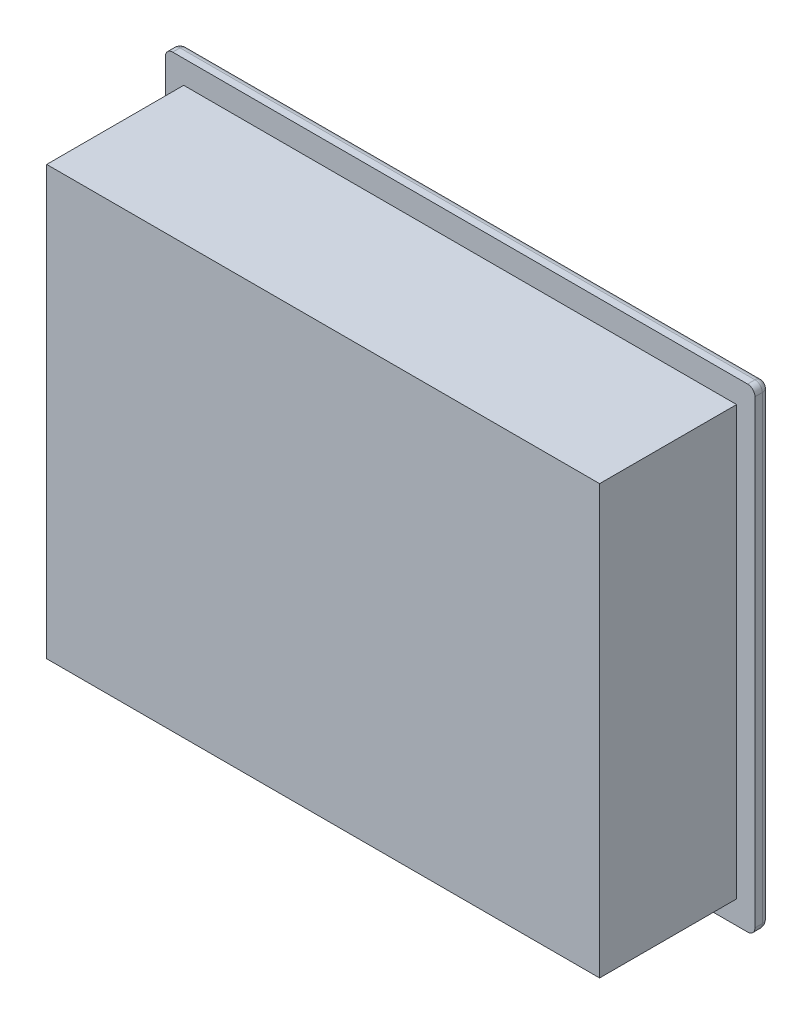
from build123d import *

# Parameters (mm, degrees)
SKETCH_1_W          = 241
SKETCH_1_H          = 194
EXTRUDE_1_DEPTH     = 6
SKETCH_2_W          = 226
SKETCH_2_H          = 175
EXTRUDE_2_DEPTH     = 56
FILLET_1_R          = 3
SKETCH_3_W          = 180
SKETCH_3_H          = 140
CUT_EXTRUDE_1_DEPTH = 1
EXTRUDE_3_DEPTH     = 1


with BuildPart() as part:
    # 草图1 → 凸台-拉伸1 (new body)
    with BuildSketch(Plane.XY):
        Rectangle(SKETCH_1_W, SKETCH_1_H)
    extrude(amount=EXTRUDE_1_DEPTH)

    # 草图2 → 凸台-拉伸2 (add)
    with BuildSketch(Plane.XY.offset(6)):
        Rectangle(SKETCH_2_W, SKETCH_2_H)
    extrude(amount=EXTRUDE_2_DEPTH)

    # 圆角1
    fillet_1_edges = [part.edges().sort_by_distance(p)[0] for p in [
        (0, -97, 0),
        (-120.5, 0, 0),
        (0, 97, 0),
        (120.5, 0, 0),
        (120.5, -97, 3),
        (-120.5, -97, 3),
        (-120.5, 97, 3),
        (120.5, 97, 3),
    ]]
    fillet(fillet_1_edges, radius=FILLET_1_R)

    # 草图3 → 切除-拉伸1 (cut)
    with BuildSketch(Plane(origin=(0, 0, 0), x_dir=(-1, 0, 0), z_dir=(0, 0, -1))):
        Rectangle(SKETCH_3_W, SKETCH_3_H)
    extrude(amount=-CUT_EXTRUDE_1_DEPTH, mode=Mode.SUBTRACT)

    # 草图4 → 凸台-拉伸3 (add)
    # profile 1 of 6: a face of its own
    with BuildSketch(Plane(origin=(0, 0, 1), x_dir=(-1, 0, 0), z_dir=(0, 0, -1))):
        with BuildLine():
            Line((-20.615877101, 5.215574709), (-21.755620691, 4.135192764))
            add(Edge.make_bspline(
                [(-21.755620691, 4.135192764), (-21.961863984, 4.329210084), (-22.369432581, 4.712618271), (-23.033897608, 5.210081483), (-23.727163658, 5.636234641), (-24.445613229, 5.982971042), (-25.17145444, 6.259631061), (-25.895052926, 6.456600188), (-26.608986395, 6.58221393), (-27.08382762, 6.59723536), (-27.317806855, 6.604637209)],
                knots=[0, 0, 0, 0, 1.08915593, 2.152340314, 3.188132944, 4.216796309, 5.218260357, 6.173443236, 7.099959455, 8, 8, 8, 8], degree=3))
            add(Edge.make_bspline(
                [(-27.317806855, 6.604637209), (-27.461379085, 6.602886277), (-27.748151184, 6.599388955), (-28.174117413, 6.554751777), (-28.595616177, 6.490553853), (-29.011851797, 6.39766657), (-29.423633576, 6.279941552), (-29.829529353, 6.132683091), (-30.230296288, 5.960999223), (-30.622159364, 5.762614751), (-31.002060829, 5.544683401), (-31.360864767, 5.303177913), (-31.700858155, 5.045838702), (-32.015650622, 4.766222889), (-32.307052913, 4.466863293), (-32.58200102, 4.15332863), (-32.830824907, 3.817052871), (-33.055577505, 3.464223055), (-33.256075023, 3.10103612), (-33.433064989, 2.730987797), (-33.581642662, 2.35530548), (-33.699200023, 1.973517751), (-33.796188458, 1.588578254), (-33.864419662, 1.197821604), (-33.902886786, 0.800829403), (-33.909540654, 0.534987675), (-33.912885648, 0.401345275)],
                knots=[0, 0, 0, 0, 1.02818874, 2.053710826, 3.065248034, 4.081641283, 5.106893873, 6.131558223, 7.173050175, 8.228653731, 9.27666206, 10.308777013, 11.325269123, 12.329503258, 13.32196095, 14.316845687, 15.314881793, 16.315733098, 17.311955233, 18.285320748, 19.252783886, 20.203351036, 21.145449891, 22.095197417, 23.042428769, 24, 24, 24, 24], degree=3))
            add(Edge.make_bspline(
                [(-33.912885648, 0.401345275), (-33.909686441, 0.264732149), (-33.903296762, -0.008121059), (-33.862401409, -0.415342633), (-33.786505191, -0.81651617), (-33.68504189, -1.212959933), (-33.558123104, -1.605352883), (-33.399912151, -1.991993841), (-33.212521109, -2.372868497), (-32.995619705, -2.744545075), (-32.757764777, -3.106592541), (-32.491305734, -3.44762785), (-32.208262598, -3.77219234), (-31.898323755, -4.07307974), (-31.571427693, -4.358338234), (-31.217807725, -4.620108611), (-30.844417309, -4.863433089), (-30.450686778, -5.085245021), (-30.040888333, -5.283401156), (-29.620701411, -5.459608983), (-29.188783658, -5.604724844), (-28.747404939, -5.722996151), (-28.297091422, -5.819940742), (-27.835557324, -5.882308242), (-27.366196192, -5.927566093), (-27.049802649, -5.930875163), (-26.890403009, -5.932542279)],
                knots=[0, 0, 0, 0, 0.93586088, 1.869166235, 2.799637598, 3.729985548, 4.670839027, 5.622275134, 6.589130586, 7.576015415, 8.568469353, 9.55398029, 10.53834874, 11.515998671, 12.510579167, 13.508179873, 14.527009472, 15.561807829, 16.601455013, 17.643573243, 18.680854198, 19.719860599, 20.772568776, 21.833555941, 22.908541556, 24, 24, 24, 24], degree=3))
            add(Edge.make_bspline(
                [(-26.890403009, -5.932542279), (-26.698301339, -5.928526639), (-26.3210785, -5.920641278), (-25.766569226, -5.859256719), (-25.234002893, -5.763385293), (-24.724875966, -5.622982997), (-24.238597112, -5.443897439), (-23.77338366, -5.22801697), (-23.332898305, -4.967061353), (-22.915816871, -4.672531983), (-22.531611452, -4.344385859), (-22.18509566, -3.990290998), (-21.881796422, -3.611966183), (-21.617193195, -3.211639681), (-21.398293225, -2.78599789), (-21.218618726, -2.337126709), (-21.080894458, -1.864824242), (-21.024358398, -1.538469668), (-20.995791631, -1.37356792)],
                knots=[0, 0, 0, 0, 1.13008108, 2.219097802, 3.278683437, 4.311054135, 5.322181354, 6.324827112, 7.324222904, 8.330512327, 9.32562643, 10.293043162, 11.24128371, 12.174520618, 13.111833804, 14.052305215, 15.015860969, 16, 16, 16, 16], degree=3))
            Line((-20.995791631, -1.37356792), (-25.93468052, -1.37356792))
            Line((-25.93468052, -1.37356792), (-25.93468052, 0.1460902))
            Line((-25.93468052, 0.1460902), (-19.666090776, 0.1460902))
            add(Edge.make_bspline(
                [(-19.666090776, 0.1460902), (-19.673312201, -0.137151503), (-19.687445834, -0.691506679), (-19.78658591, -1.499947493), (-19.946675812, -2.263520994), (-20.165371132, -2.983031331), (-20.448476486, -3.657458874), (-20.792953523, -4.287488374), (-21.204315502, -4.869049656), (-21.667909704, -5.406890438), (-22.188186192, -5.88665077), (-22.751086683, -6.308315907), (-23.357541183, -6.663503645), (-24.006976034, -6.952473783), (-24.697265203, -7.178000361), (-25.43000601, -7.337900036), (-26.204204787, -7.433700214), (-26.734796719, -7.445940387), (-27.006158217, -7.452200398)],
                knots=[0, 0, 0, 0, 1.140356446, 2.231883559, 3.274166699, 4.278491846, 5.25512956, 6.21435461, 7.1637429, 8.11826594, 9.068280886, 10.0076534, 10.945064095, 11.891975133, 12.864533718, 13.863980011, 14.907571808, 16, 16, 16, 16], degree=3))
            add(Edge.make_bspline(
                [(-27.006158217, -7.452200398), (-27.173417791, -7.449791118), (-27.503307575, -7.445039242), (-27.990525838, -7.411268471), (-28.464310431, -7.359280698), (-28.924592336, -7.280773009), (-29.373064651, -7.184614306), (-29.80748756, -7.06148053), (-30.229515935, -6.918949703), (-30.639802074, -6.756831352), (-31.034621989, -6.568991339), (-31.415734244, -6.360247198), (-31.78524551, -6.131675304), (-32.140638775, -5.879322724), (-32.483765772, -5.605076976), (-32.812414017, -5.308388386), (-33.128423368, -4.990163979), (-33.326375997, -4.764192838), (-33.426120157, -4.65033074)],
                knots=[0, 0, 0, 0, 1.107784379, 2.184907829, 3.233506516, 4.263428166, 5.276301166, 6.270063455, 7.25232949, 8.225834625, 9.190232166, 10.146266622, 11.1027726, 12.066435141, 13.031522626, 14.010570082, 14.99756817, 16, 16, 16, 16], degree=3))
            add(Edge.make_bspline(
                [(-33.426120157, -4.65033074), (-33.570840602, -4.469691642), (-33.857879282, -4.11141187), (-34.227356812, -3.537372105), (-34.54232275, -2.94300423), (-34.797879864, -2.326653637), (-34.997431096, -1.688896836), (-35.140544233, -1.03054877), (-35.22439509, -0.350761667), (-35.236475066, 0.10925462), (-35.242586503, 0.34198363)],
                knots=[0, 0, 0, 0, 1.023165419, 2.029347347, 3.013907458, 3.994755782, 4.975994455, 5.96558838, 6.970761222, 8, 8, 8, 8], degree=3))
            add(Edge.make_bspline(
                [(-35.242586503, 0.34198363), (-35.240333361, 0.516254099), (-35.235855714, 0.862580167), (-35.181561029, 1.376749436), (-35.103661693, 1.881789033), (-34.989162495, 2.377286121), (-34.844821641, 2.863571626), (-34.664678551, 3.34087134), (-34.454938491, 3.809466929), (-34.211159891, 4.266132971), (-33.939869012, 4.704809651), (-33.645439746, 5.123731019), (-33.323691172, 5.515268061), (-32.97987762, 5.884379372), (-32.609897029, 6.226427824), (-32.217215468, 6.544580226), (-31.801530317, 6.839263346), (-31.361533822, 7.105835646), (-30.903793291, 7.345288306), (-30.429405951, 7.555215969), (-29.938516615, 7.728712004), (-29.43480296, 7.875921005), (-28.914452207, 7.984781767), (-28.381240434, 8.063728122), (-27.832388293, 8.117747994), (-27.461395769, 8.122092477), (-27.273285621, 8.124295328)],
                knots=[0, 0, 0, 0, 1.008945113, 2.00506715, 2.99143336, 3.967273523, 4.948097931, 5.927297278, 6.919902385, 7.919676788, 8.923139349, 9.905703106, 10.883022732, 11.856032218, 12.825136022, 13.798837087, 14.781400844, 15.773989409, 16.776158564, 17.77167057, 18.775803737, 19.789618931, 20.80898985, 21.851988756, 22.910860228, 24, 24, 24, 24], degree=3))
            add(Edge.make_bspline(
                [(-27.273285621, 8.124295328), (-27.119877056, 8.121842147), (-26.8156859, 8.116977775), (-26.363033633, 8.083260765), (-25.917377871, 8.029819669), (-25.478057821, 7.956892939), (-25.046569537, 7.857563316), (-24.621683817, 7.738698577), (-24.202784747, 7.600303195), (-23.791185159, 7.435250412), (-23.384117494, 7.247910067), (-22.97931837, 7.037033245), (-22.578170895, 6.799014059), (-22.179979407, 6.533145758), (-21.782232942, 6.243994623), (-21.391222623, 5.923290736), (-20.997510159, 5.58368107), (-20.744349145, 5.339493158), (-20.615877101, 5.215574709)],
                knots=[0, 0, 0, 0, 0.985871117, 1.954866573, 2.915460327, 3.869826059, 4.81536089, 5.759505086, 6.70452669, 7.649098992, 8.607881297, 9.583363685, 10.581137262, 11.603961102, 12.659522466, 13.73993555, 14.853081303, 16, 16, 16, 16], degree=3))
        make_face()
    # profile 2 of 6: a face of its own
    with BuildSketch(Plane(origin=(0, 0, 1), x_dir=(-1, 0, 0), z_dir=(0, 0, -1))):
        Polygon((-18.336389922, 6.224722679), (-18.336389922, 7.744380798), (-10.548142058, 7.744380798), (-10.548142058, 6.224722679), (-13.777415563, 6.224722679), (-13.777415563, -7.072285868), (-15.107116417, -7.072285868), (-15.107116417, 6.224722679), align=None)
    # profile 3 of 6: a face of its own
    with BuildSketch(Plane(origin=(0, 0, 1), x_dir=(-1, 0, 0), z_dir=(0, 0, -1))):
        with BuildLine():
            Line((-7.698783084, 3.185406439), (-9.028483939, 3.185406439))
            add(Edge.make_bspline(
                [(-9.028483939, 3.185406439), (-9.019817658, 3.361813198), (-9.002797312, 3.708271376), (-8.923090888, 4.213409246), (-8.809041174, 4.696241228), (-8.647787352, 5.15289053), (-8.44752411, 5.587394814), (-8.207366994, 5.998028214), (-7.922913026, 6.383224246), (-7.600304519, 6.739412016), (-7.24991728, 7.066172732), (-6.87185547, 7.348346594), (-6.474578188, 7.586758069), (-6.059290732, 7.786068659), (-5.62130768, 7.935674007), (-5.164603582, 8.046678948), (-4.687171904, 8.113465478), (-4.361882477, 8.120644304), (-4.196446011, 8.124295328)],
                knots=[0, 0, 0, 0, 1.10065271, 2.161652631, 3.183658789, 4.190468796, 5.17591951, 6.163126047, 7.15150782, 8.156236427, 9.156009102, 10.134482811, 11.092018607, 12.041330605, 13.001268258, 13.972401359, 14.968799086, 16, 16, 16, 16], degree=3))
            add(Edge.make_bspline(
                [(-4.196446011, 8.124295328), (-4.033978831, 8.120491863), (-3.714736625, 8.113018189), (-3.248807431, 8.048836498), (-2.805250218, 7.948313493), (-2.384932006, 7.807278231), (-1.991206333, 7.617690822), (-1.621115444, 7.389947908), (-1.270253345, 7.126550622), (-0.954417961, 6.816442812), (-0.664400426, 6.485386051), (-0.414200879, 6.131953925), (-0.199938487, 5.766916616), (-0.021343975, 5.387490563), (0.110127013, 4.990103209), (0.209941427, 4.58054005), (0.266360812, 4.154561684), (0.275019771, 3.866243932), (0.279422044, 3.719661247)],
                knots=[0, 0, 0, 0, 1.111607364, 2.184268762, 3.212621178, 4.221274766, 5.211760367, 6.196651075, 7.1921475, 8.207485113, 9.220403448, 10.201281604, 11.166441695, 12.114753415, 13.065576456, 14.026450734, 14.996634279, 16, 16, 16, 16], degree=3))
            add(Edge.make_bspline(
                [(0.279422044, 3.719661247), (0.272253898, 3.513295414), (0.258043397, 3.104185176), (0.136485869, 2.502988924), (-0.053364361, 1.920510116), (-0.281953172, 1.451722204), (-0.512553185, 1.073967081), (-0.720356967, 0.762949563), (-0.963624667, 0.428069747), (-1.245896975, 0.070449019), (-1.5613348, -0.312713813), (-1.912795292, -0.72118728), (-2.302784699, -1.150751106), (-2.576505686, -1.444144818), (-2.718341043, -1.596174089)],
                knots=[0, 0, 0, 0, 1.184426356, 2.348067706, 3.509069118, 4.696110526, 5.333549288, 6.050745305, 6.844228056, 7.710549037, 8.667450064, 9.695053472, 10.805634456, 12, 12, 12, 12], degree=3))
            Line((-2.718341043, -1.596174089), (-6.425475792, -5.552627749))
            Line((-6.425475792, -5.552627749), (0.469379309, -5.552627749))
            Line((0.469379309, -5.552627749), (0.469379309, -7.072285868))
            Line((0.469379309, -7.072285868), (-9.598355733, -7.072285868))
            Line((-9.598355733, -7.072285868), (-3.852148469, -0.940227909))
            add(Edge.make_bspline(
                [(-3.852148469, -0.940227909), (-3.712245748, -0.794185078), (-3.443521253, -0.513666688), (-3.063441678, -0.10412149), (-2.722069961, 0.275818232), (-2.417196331, 0.625434621), (-2.155434492, 0.949841591), (-1.923142043, 1.238532503), (-1.737021041, 1.504193009), (-1.535025866, 1.812128275), (-1.339386678, 2.188100418), (-1.171271038, 2.647559702), (-1.068761513, 3.120538405), (-1.056464376, 3.440163695), (-1.05027881, 3.600937956)],
                knots=[0, 0, 0, 0, 1.329631726, 2.553950428, 3.673215718, 4.687767853, 5.603093632, 6.413772471, 7.123043292, 7.734684054, 8.834405432, 9.900288307, 10.943827018, 12, 12, 12, 12], degree=3))
            add(Edge.make_bspline(
                [(-1.05027881, 3.600937956), (-1.052970119, 3.702035876), (-1.058274173, 3.901280463), (-1.105085092, 4.193404843), (-1.175826235, 4.475195888), (-1.277194494, 4.747520376), (-1.41099636, 5.007640303), (-1.573867002, 5.255872302), (-1.761784937, 5.495855588), (-1.979171977, 5.720871217), (-2.217980744, 5.926954986), (-2.470263068, 6.109513615), (-2.737175176, 6.262079184), (-3.017591693, 6.387146655), (-3.310730847, 6.485255769), (-3.617159601, 6.553237088), (-3.93603127, 6.595919604), (-4.153766402, 6.601694598), (-4.264711903, 6.604637209)],
                knots=[0, 0, 0, 0, 0.991446411, 1.95395049, 2.89581595, 3.838931463, 4.798493298, 5.75982156, 6.748411868, 7.785213223, 8.824556874, 9.840280684, 10.836137867, 11.835679398, 12.848801643, 13.863922112, 14.911575587, 16, 16, 16, 16], degree=3))
            add(Edge.make_bspline(
                [(-4.264711903, 6.604637209), (-4.380581762, 6.601610239), (-4.608131033, 6.59566577), (-4.942221605, 6.554083159), (-5.260931397, 6.482345768), (-5.565062119, 6.384231179), (-5.855128366, 6.259523323), (-6.129719486, 6.104194937), (-6.38821905, 5.918844816), (-6.631112999, 5.708699794), (-6.854903844, 5.474733616), (-7.051528952, 5.213918105), (-7.223334612, 4.93101538), (-7.3732337, 4.626788783), (-7.494966121, 4.298477781), (-7.587985792, 3.94724783), (-7.661590109, 3.574623982), (-7.686179513, 3.317300456), (-7.698783084, 3.185406439)],
                knots=[0, 0, 0, 0, 1.031018746, 2.02475058, 2.990194455, 3.934040569, 4.864654155, 5.795059489, 6.735614925, 7.690564532, 8.649604399, 9.611025574, 10.590972636, 11.591080095, 12.624614302, 13.701020113, 14.821632451, 16, 16, 16, 16], degree=3))
        make_face()
    # profile 4 of 6: a face of its own
    with BuildSketch(Plane(origin=(0, 0, 1), x_dir=(-1, 0, 0), z_dir=(0, 0, -1))):
        with BuildLine():
            Line((3.698652814, 4.325150029), (2.368951959, 4.325150029))
            add(Edge.make_bspline(
                [(2.368951959, 4.325150029), (2.404975723, 4.474300878), (2.475399237, 4.765878588), (2.622285631, 5.182469325), (2.782302478, 5.576692233), (2.974449687, 5.941165611), (3.184036747, 6.2832143), (3.424162935, 6.59508026), (3.68374976, 6.884695147), (3.970875379, 7.141714519), (4.271986713, 7.374453573), (4.591326603, 7.572891316), (4.922470187, 7.743596896), (5.267711783, 7.884229211), (5.628079243, 7.990170595), (6.000314648, 8.067034405), (6.385393465, 8.116950122), (6.646791599, 8.121821685), (6.779522205, 8.124295328)],
                knots=[0, 0, 0, 0, 1.162005537, 2.271625781, 3.343758855, 4.383309926, 5.390229558, 6.379919256, 7.361854164, 8.333198761, 9.295911338, 10.242430842, 11.177959212, 12.116337295, 13.062827104, 14.020064771, 14.994644689, 16, 16, 16, 16], degree=3))
            add(Edge.make_bspline(
                [(6.779522205, 8.124295328), (6.972912479, 8.118456587), (7.355474626, 8.106906464), (7.917504858, 8.00143535), (8.459485059, 7.834535623), (8.975482874, 7.603930178), (9.454774239, 7.319503885), (9.881224096, 6.980986499), (10.249052125, 6.594909456), (10.557638324, 6.168474934), (10.79925582, 5.712733278), (10.977421468, 5.243679279), (11.085886584, 4.7624256), (11.099943608, 4.437486452), (11.106986147, 4.274692631)],
                knots=[0, 0, 0, 0, 1.083050992, 2.142477498, 3.193116406, 4.255571735, 5.30263384, 6.308962982, 7.297363603, 8.282367274, 9.249857812, 10.179914175, 11.08814088, 12, 12, 12, 12], degree=3))
            add(Edge.make_bspline(
                [(11.106986147, 4.274692631), (11.102060278, 4.118030533), (11.092421117, 3.811467119), (11.010575097, 3.363912781), (10.872838251, 2.942096673), (10.682042923, 2.544243087), (10.435063693, 2.172874598), (10.13588261, 1.82715566), (9.782388008, 1.505552891), (9.514507171, 1.321320455), (9.376594186, 1.226472144)],
                knots=[0, 0, 0, 0, 1.024540389, 2.004866551, 2.965041327, 3.920577974, 4.882998113, 5.874504559, 6.905732034, 8, 8, 8, 8], degree=3))
            add(Edge.make_bspline(
                [(9.376594186, 1.226472144), (9.534208614, 1.150364552), (9.846488382, 0.999573398), (10.27215229, 0.703850691), (10.658561963, 0.362405487), (10.874054373, 0.095948256), (10.982326692, -0.0379309)],
                knots=[0, 0, 0, 0, 1.015518401, 2.012035669, 3.001164323, 4, 4, 4, 4], degree=3))
            add(Edge.make_bspline(
                [(10.982326692, -0.0379309), (11.053621708, -0.135542049), (11.195044234, -0.329165896), (11.369607994, -0.640470099), (11.527973244, -0.955224737), (11.65137584, -1.281866222), (11.746938543, -1.616608647), (11.815247746, -1.96002679), (11.857683275, -2.312401085), (11.863760446, -2.550790585), (11.866815207, -2.670619869)],
                knots=[0, 0, 0, 0, 1.025084078, 2.033381695, 3.024893161, 4.013698104, 4.991890475, 5.976764909, 6.982997093, 8, 8, 8, 8], degree=3))
            add(Edge.make_bspline(
                [(11.866815207, -2.670619869), (11.859218433, -2.878094356), (11.844060636, -3.29206695), (11.708576721, -3.903676605), (11.498547335, -4.501531231), (11.20027964, -5.073348051), (10.836773852, -5.60835833), (10.404307847, -6.087048039), (9.907795384, -6.49852213), (9.354051471, -6.842312096), (8.754115627, -7.1171313), (8.112445621, -7.307874475), (7.438287059, -7.432105873), (6.975976166, -7.445427618), (6.740937135, -7.452200398)],
                knots=[0, 0, 0, 0, 0.955779014, 1.907060117, 2.875433937, 3.871313158, 4.872415639, 5.851225146, 6.836215519, 7.83643374, 8.849228613, 9.86973379, 10.916971861, 12, 12, 12, 12], degree=3))
            add(Edge.make_bspline(
                [(6.740937135, -7.452200398), (6.582528764, -7.448524962), (6.270833912, -7.441292929), (5.812603103, -7.391853518), (5.375207909, -7.301556496), (4.958056944, -7.180045836), (4.560779624, -7.025987461), (4.184588245, -6.834138306), (3.827168362, -6.608452948), (3.491892803, -6.346267426), (3.178801533, -6.052976421), (2.896215, -5.723373279), (2.639421877, -5.363550936), (2.415298039, -4.969329998), (2.21363494, -4.545805075), (2.04776889, -4.087553099), (1.901779983, -3.598670739), (1.833904984, -3.257981639), (1.799080164, -3.083183304)],
                knots=[0, 0, 0, 0, 1.048658725, 2.063410685, 3.046034179, 4.001477787, 4.936774919, 5.862367409, 6.792675028, 7.730719943, 8.675894397, 9.627829632, 10.600096036, 11.597688215, 12.626045268, 13.701542398, 14.82072376, 16, 16, 16, 16], degree=3))
            Line((1.799080164, -3.083183304), (3.128781019, -3.083183304))
            add(Edge.make_bspline(
                [(3.128781019, -3.083183304), (3.163423619, -3.19726746), (3.230806486, -3.419171054), (3.345505681, -3.738535014), (3.476181366, -4.031304106), (3.616366331, -4.299625989), (3.763595086, -4.54614316), (3.928334936, -4.764337072), (4.098384317, -4.963791428), (4.226566913, -5.076163619), (4.289301184, -5.131160067)],
                knots=[0, 0, 0, 0, 1.198163088, 2.33053128, 3.407730985, 4.417276592, 5.372219308, 6.28897303, 7.162600585, 8, 8, 8, 8], degree=3))
            add(Edge.make_bspline(
                [(4.289301184, -5.131160067), (4.372260025, -5.195118681), (4.537921631, -5.322838482), (4.807873809, -5.485828709), (5.091781827, -5.62705705), (5.395797281, -5.734938028), (5.71335981, -5.826283459), (6.049602322, -5.886060323), (6.401558342, -5.927073582), (6.641875207, -5.930692792), (6.764681793, -5.932542279)],
                knots=[0, 0, 0, 0, 0.946170439, 1.889420265, 2.845303464, 3.807233317, 4.801018734, 5.828864929, 6.890507805, 8, 8, 8, 8], degree=3))
            add(Edge.make_bspline(
                [(6.764681793, -5.932542279), (6.903338288, -5.929934946), (7.174469093, -5.924836533), (7.570094664, -5.877949374), (7.946469526, -5.809663957), (8.299414911, -5.704198997), (8.633554059, -5.573893392), (8.944203043, -5.410281809), (9.235439892, -5.218322488), (9.503534375, -5.000140049), (9.74460369, -4.761289054), (9.956860963, -4.511467053), (10.137305363, -4.251727374), (10.282862511, -3.980632662), (10.39779984, -3.699305527), (10.47604539, -3.406956483), (10.530450137, -3.105978056), (10.534880795, -2.90138542), (10.537114352, -2.798247407)],
                knots=[0, 0, 0, 0, 1.217147791, 2.380027433, 3.494444702, 4.572153297, 5.609568379, 6.639424714, 7.649109417, 8.668170816, 9.669597737, 10.625200337, 11.543417969, 12.441394052, 13.322311151, 14.205496177, 15.095365482, 16, 16, 16, 16], degree=3))
            add(Edge.make_bspline(
                [(10.537114352, -2.798247407), (10.530636076, -2.660192739), (10.517711758, -2.384770344), (10.419038771, -1.979565946), (10.256737579, -1.5891535), (10.029523948, -1.220193989), (9.75293603, -0.878242672), (9.429657925, -0.573140063), (9.057005091, -0.321383344), (8.714020979, -0.147441366), (8.41021515, -0.028751081), (8.150223356, 0.050306269), (7.859153735, 0.117250744), (7.540526191, 0.179532694), (7.191939908, 0.232539734), (6.813774387, 0.276743421), (6.405952997, 0.312113094), (6.123627061, 0.327908064), (5.978139993, 0.336047465)],
                knots=[0, 0, 0, 0, 1.07054697, 2.135767047, 3.216561865, 4.33974944, 5.486079747, 6.621378074, 7.775625952, 8.963672916, 9.598146892, 10.304877434, 11.070270905, 11.915000392, 12.823868403, 13.805723172, 14.86925407, 16, 16, 16, 16], degree=3))
            Line((5.978139993, 0.336047465), (5.978139993, 1.855705585))
            add(Edge.make_bspline(
                [(5.978139993, 1.855705585), (6.161448261, 1.858816254), (6.520504128, 1.86490929), (7.044990018, 1.938603201), (7.54652704, 2.040544526), (8.014000248, 2.19669184), (8.440079801, 2.378049097), (8.809732783, 2.589090117), (9.117780373, 2.823679223), (9.362725576, 3.085437269), (9.54699931, 3.36617097), (9.681732753, 3.658764821), (9.761320801, 3.965783345), (9.771945057, 4.175310773), (9.777285292, 4.280628795)],
                knots=[0, 0, 0, 0, 1.321986639, 2.589447074, 3.816329219, 5.01088745, 6.139805852, 7.153945165, 8.075214402, 8.924034688, 9.728124013, 10.488707548, 11.240355623, 12, 12, 12, 12], degree=3))
            add(Edge.make_bspline(
                [(9.777285292, 4.280628795), (9.775530952, 4.358004583), (9.772040777, 4.511940043), (9.728025634, 4.736836167), (9.661883861, 4.954856838), (9.570953007, 5.165074902), (9.449243832, 5.366032394), (9.303591822, 5.559442595), (9.130160198, 5.744201259), (8.931424472, 5.916414612), (8.718014498, 6.080537716), (8.484123783, 6.219872113), (8.236804514, 6.339019542), (7.975782875, 6.437273101), (7.700211797, 6.511184088), (7.411386036, 6.564252483), (7.108754842, 6.597431888), (6.902287844, 6.602208849), (6.797330698, 6.604637209)],
                knots=[0, 0, 0, 0, 0.884392785, 1.759457502, 2.611959086, 3.489218968, 4.37281399, 5.2945488, 6.255912374, 7.266815255, 8.301784654, 9.332968512, 10.37626691, 11.440494194, 12.520033166, 13.637162961, 14.798855837, 16, 16, 16, 16], degree=3))
            add(Edge.make_bspline(
                [(6.797330698, 6.604637209), (6.628625304, 6.598747109), (6.29910443, 6.587242376), (5.824061282, 6.486476286), (5.382442768, 6.325702399), (5.044882413, 6.133792617), (4.795612849, 5.944349113), (4.617487144, 5.778900344), (4.44256365, 5.595034724), (4.282350284, 5.381427602), (4.120323783, 5.152544857), (3.972815139, 4.896751272), (3.829475776, 4.620719336), (3.743104982, 4.42558115), (3.698652814, 4.325150029)],
                knots=[0, 0, 0, 0, 1.472543308, 2.876219568, 4.221790263, 5.565193594, 6.249813518, 6.953379497, 7.687249741, 8.463570142, 9.283606569, 10.136032583, 11.040678096, 12, 12, 12, 12], degree=3))
        make_face()
    # profile 5 of 6: a face of its own
    with BuildSketch(Plane(origin=(0, 0, 1), x_dir=(-1, 0, 0), z_dir=(0, 0, -1))):
        with BuildLine():
            add(Edge.make_bspline(
                [(13.196516061, 0.3301113), (13.197904672, 0.567590242), (13.200602067, 1.028896509), (13.230609716, 1.701084827), (13.280458665, 2.331683383), (13.348773543, 2.920722363), (13.431907659, 3.468353833), (13.542886553, 3.973114305), (13.669094084, 4.437339973), (13.815366104, 4.862544644), (13.980414411, 5.254456921), (14.160052782, 5.620323606), (14.361410411, 5.95959112), (14.572979343, 6.277674432), (14.803323779, 6.56936674), (15.045888659, 6.838787345), (15.310141268, 7.079709522), (15.58709867, 7.299192202), (15.879268369, 7.491594965), (16.178322323, 7.661066892), (16.486318937, 7.80584633), (16.804099112, 7.919682509), (17.128806607, 8.013708427), (17.461576522, 8.078008305), (17.802958296, 8.118465884), (18.033384704, 8.122333745), (18.150245362, 8.124295328)],
                knots=[0, 0, 0, 0, 1.646270934, 3.197905019, 4.663502075, 6.030701355, 7.308322542, 8.50163776, 9.611534131, 10.641858119, 11.616356847, 12.558055219, 13.465016945, 14.349605745, 15.204443733, 16.039544428, 16.859896111, 17.680448484, 18.487036065, 19.28249412, 20.06191084, 20.843045899, 21.620316918, 22.403196591, 23.190181807, 24, 24, 24, 24], degree=3))
            add(Edge.make_bspline(
                [(18.150245362, 8.124295328), (18.268082221, 8.122230244), (18.502422658, 8.118123441), (18.848880247, 8.078652084), (19.187333899, 8.013157663), (19.516340686, 7.920358871), (19.838603129, 7.805230506), (20.151600588, 7.660928377), (20.457277234, 7.492954506), (20.750775451, 7.295580092), (21.035317323, 7.075521789), (21.303913699, 6.826759824), (21.55658903, 6.551806013), (21.796514489, 6.253602122), (22.016883184, 5.926428597), (22.226744047, 5.575975865), (22.414585666, 5.196115204), (22.595495791, 4.793184557), (22.751650701, 4.356035068), (22.892477806, 3.887130915), (23.00626544, 3.380933524), (23.101046693, 2.840098752), (23.174473419, 2.262640407), (23.227951604, 1.649796338), (23.256200997, 1.001163351), (23.261521032, 0.557688456), (23.264251104, 0.3301113)],
                knots=[0, 0, 0, 0, 0.810914788, 1.612654377, 2.396697861, 3.181598691, 3.963628158, 4.749916497, 5.551656086, 6.361998678, 7.18212741, 8.025565596, 8.878627764, 9.750805457, 10.657531673, 11.591944965, 12.560506719, 13.57287815, 14.630710178, 15.753379473, 16.941251878, 18.199788006, 19.531962791, 20.947069417, 22.433333509, 24, 24, 24, 24], degree=3))
            add(Edge.make_bspline(
                [(23.264251104, 0.3301113), (23.26149273, 0.103526757), (23.256118149, -0.337963986), (23.228268291, -0.983678448), (23.173410085, -1.593270165), (23.104787801, -2.168201123), (23.009745391, -2.706078376), (22.892883521, -3.208763207), (22.763130488, -3.678426444), (22.602963193, -4.11122048), (22.427657852, -4.513182773), (22.236924188, -4.888540368), (22.032581925, -5.240611007), (21.809956237, -5.566576602), (21.572663455, -5.868746251), (21.315624816, -6.141786187), (21.046086005, -6.392275365), (20.760706778, -6.615167254), (20.462631211, -6.810259594), (20.158004453, -6.98473156), (19.841421463, -7.125416636), (19.52005663, -7.246214976), (19.189313213, -7.338503556), (18.849603493, -7.402316211), (18.502655427, -7.447070369), (18.268122135, -7.450484468), (18.150245362, -7.452200398)],
                knots=[0, 0, 0, 0, 1.561518951, 3.042555995, 4.452378317, 5.7783523, 7.031515105, 8.214008947, 9.334062868, 10.386615937, 11.391082383, 12.354592575, 13.286541444, 14.194233754, 15.072674879, 15.931287219, 16.775624067, 17.606195743, 18.42308326, 19.229000347, 20.022332153, 20.807536673, 21.593273796, 22.3848459, 23.188221202, 24, 24, 24, 24], degree=3))
            add(Edge.make_bspline(
                [(18.150245362, -7.452200398), (18.033387946, -7.45022616), (17.802967931, -7.446333348), (17.46153933, -7.406058551), (17.130143653, -7.341307588), (16.807145594, -7.250643964), (16.490888013, -7.139667823), (16.1856804, -6.995083896), (15.888129206, -6.828569671), (15.599028285, -6.63893572), (15.323810137, -6.421673928), (15.060926041, -6.181371773), (14.816980127, -5.912032665), (14.589929122, -5.617909457), (14.374138815, -5.301708065), (14.175640468, -4.959111285), (13.992037186, -4.591477568), (13.824213075, -4.196431746), (13.675417067, -3.768209218), (13.543981769, -3.301911029), (13.440205169, -2.793421503), (13.351377325, -2.246824648), (13.27973077, -1.659771677), (13.230817459, -1.031943882), (13.200585892, -0.363732498), (13.197897427, 0.094609547), (13.196516061, 0.3301113)],
                knots=[0, 0, 0, 0, 0.810891512, 1.598919785, 2.382837074, 3.152667961, 3.926044502, 4.706494248, 5.493654104, 6.291793342, 7.103789334, 7.925228297, 8.761435821, 9.622817696, 10.50288917, 11.416980706, 12.369136599, 13.353924996, 14.394355917, 15.514179734, 16.714354668, 17.994756427, 19.357759367, 20.818452758, 22.365282078, 24, 24, 24, 24], degree=3))
        make_face()
        with BuildLine():
            add(Edge.make_bspline(
                [(14.526216916, 0.336047465), (14.526722575, 0.13814464), (14.527703961, -0.245945883), (14.553341876, -0.804082354), (14.588267859, -1.324656746), (14.633316017, -1.808330051), (14.700215165, -2.253465104), (14.7751739, -2.663123429), (14.866394147, -3.035137066), (14.974323056, -3.372058798), (15.097255232, -3.679606521), (15.231476722, -3.965784998), (15.375667116, -4.233974863), (15.537038186, -4.481767138), (15.712785287, -4.709969899), (15.898938751, -4.922622223), (16.102446024, -5.112262777), (16.383978534, -5.339706464), (16.755650276, -5.574737463), (17.223943537, -5.779402577), (17.705139979, -5.908021642), (18.031746938, -5.924378209), (18.194766596, -5.932542279)],
                knots=[0, 0, 0, 0, 1.459021318, 2.831673884, 4.118529203, 5.306027144, 6.411944654, 7.436330062, 8.375795394, 9.233974572, 10.042671642, 10.816086306, 11.563610507, 12.285937304, 12.993564865, 13.685989202, 14.367179055, 15.041617293, 16.353048772, 17.594441528, 18.799311195, 20, 20, 20, 20], degree=3))
            add(Edge.make_bspline(
                [(18.194766596, -5.932542279), (18.358840739, -5.92577834), (18.686650274, -5.912264427), (19.16558334, -5.781883106), (19.630531483, -5.585162055), (19.994902697, -5.352550949), (20.272112131, -5.131027688), (20.470727389, -4.94215901), (20.653023394, -4.730679172), (20.825921511, -4.502505486), (20.984498265, -4.253278636), (21.128698881, -3.984197067), (21.260285052, -3.694513547), (21.335253347, -3.492288319), (21.373582701, -3.388895778)],
                knots=[0, 0, 0, 0, 1.353760809, 2.704726607, 4.075137775, 5.516104923, 6.260822281, 7.007110065, 7.778089737, 8.566572457, 9.372053459, 10.217411131, 11.088608312, 12, 12, 12, 12], degree=3))
            add(Edge.make_bspline(
                [(21.373582701, -3.388895778), (21.418251852, -3.25668988), (21.508949384, -2.988255212), (21.625839228, -2.571849085), (21.717894751, -2.134957384), (21.800713, -1.680191057), (21.857240936, -1.204196322), (21.902740012, -0.708445964), (21.929539921, -0.192566197), (21.932862033, 0.157932599), (21.934550249, 0.336047465)],
                knots=[0, 0, 0, 0, 0.884706709, 1.796334032, 2.740027952, 3.714592787, 4.726048262, 5.777819803, 6.87074269, 8, 8, 8, 8], degree=3))
            add(Edge.make_bspline(
                [(21.934550249, 0.336047465), (21.932221115, 0.514133522), (21.92766483, 0.86250792), (21.910248949, 1.372701551), (21.865275817, 1.857281739), (21.815326214, 2.318336073), (21.741677978, 2.753312355), (21.662269929, 3.16585198), (21.555584797, 3.550844119), (21.441624416, 3.914316348), (21.311193741, 4.252139119), (21.167617133, 4.565887481), (21.014278354, 4.857076149), (20.847729536, 5.124906202), (20.669947811, 5.3705773), (20.476240853, 5.58916375), (20.274292342, 5.787440249), (19.991432922, 6.013765125), (19.621125095, 6.244531302), (19.160345188, 6.456899685), (18.680832794, 6.578854791), (18.356671838, 6.596049266), (18.194766596, 6.604637209)],
                knots=[0, 0, 0, 0, 1.31362396, 2.569729283, 3.763502607, 4.902122613, 5.988968491, 7.01645872, 7.998833611, 8.933434873, 9.825090667, 10.667526885, 11.477055099, 12.250526234, 12.991942729, 13.710640831, 14.402115721, 15.076753259, 16.378508321, 17.609869233, 18.806226677, 20, 20, 20, 20], degree=3))
            add(Edge.make_bspline(
                [(18.194766596, 6.604637209), (18.030891756, 6.596037418), (17.702843535, 6.578822169), (17.218347194, 6.457354063), (16.753932105, 6.245632507), (16.384603512, 6.013000797), (16.101546816, 5.791435278), (15.902230081, 5.599299289), (15.715344618, 5.389130146), (15.543184688, 5.158828706), (15.381940056, 4.911325318), (15.233853769, 4.644672881), (15.100430407, 4.357520105), (14.97730587, 4.050110529), (14.869047734, 3.713217864), (14.779749957, 3.341662458), (14.697254765, 2.933307116), (14.638854793, 2.485761199), (14.586938227, 2.00196675), (14.553573854, 1.480092769), (14.527618198, 0.921020226), (14.526693365, 0.534943788), (14.526216916, 0.336047465)],
                knots=[0, 0, 0, 0, 1.207732386, 2.417664972, 3.655092373, 4.956220595, 5.625982001, 6.301752483, 6.994047911, 7.697131622, 8.419323945, 9.170223765, 9.943494443, 10.752040957, 11.610060368, 12.549350801, 13.567764191, 14.679664412, 15.874934091, 17.154273443, 18.533957287, 20, 20, 20, 20], degree=3))
        make_face(mode=Mode.SUBTRACT)
    # profile 6 of 6: a face of its own
    with BuildSketch(Plane(origin=(0, 0, 1), x_dir=(-1, 0, 0), z_dir=(0, 0, -1))):
        with BuildLine():
            add(Edge.make_bspline(
                [(31.797487616, 1.181950911), (31.918766465, 1.118713564), (32.155300725, 0.995379618), (32.492177573, 0.796790447), (32.800046745, 0.587490363), (33.087450124, 0.377365225), (33.349338309, 0.1583679), (33.58278299, -0.070372461), (33.793550581, -0.303146296), (33.977390633, -0.543895286), (34.139090575, -0.791979834), (34.278841947, -1.04805109), (34.398294773, -1.311547869), (34.492964547, -1.585346449), (34.570950132, -1.86542489), (34.624610193, -2.15539968), (34.653468478, -2.453360057), (34.658924455, -2.654732534), (34.661687002, -2.756694255)],
                knots=[0, 0, 0, 0, 1.272397273, 2.481599622, 3.635517121, 4.734568067, 5.792894095, 6.808321871, 7.773003508, 8.711915296, 9.623354172, 10.525449501, 11.423591555, 12.311487226, 13.218079475, 14.126165749, 15.051214107, 16, 16, 16, 16], degree=3))
            add(Edge.make_bspline(
                [(34.661687002, -2.756694255), (34.658421321, -2.89934799), (34.651957315, -3.181713257), (34.595654049, -3.598468462), (34.511355773, -4.003225006), (34.388252505, -4.39589415), (34.22859915, -4.774309164), (34.031847211, -5.138793972), (33.809126443, -5.49532238), (33.63025863, -5.714691181), (33.539751905, -5.825691317)],
                knots=[0, 0, 0, 0, 1.025265484, 2.029385089, 3.018602448, 3.995076438, 4.983346944, 5.966715145, 6.97116228, 8, 8, 8, 8], degree=3))
            add(Edge.make_bspline(
                [(33.539751905, -5.825691317), (33.421910831, -5.955204961), (33.187684877, -6.212631813), (32.78643715, -6.546856909), (32.346077842, -6.827736011), (31.8683109, -7.056640364), (31.354413437, -7.234803834), (30.804494951, -7.362830493), (30.217483371, -7.43616211), (29.814023543, -7.446762333), (29.607042904, -7.452200398)],
                knots=[0, 0, 0, 0, 0.954267603, 1.896743057, 2.838368354, 3.796610408, 4.779680527, 5.799409237, 6.871065594, 8, 8, 8, 8], degree=3))
            add(Edge.make_bspline(
                [(29.607042904, -7.452200398), (29.408019559, -7.447321575), (29.020740345, -7.43782788), (28.457038663, -7.373504787), (27.931584334, -7.260780151), (27.441322135, -7.106497972), (26.989207667, -6.905794672), (26.576529205, -6.655992408), (26.197332722, -6.367145969), (25.863125984, -6.030959705), (25.566418239, -5.670881379), (25.305780147, -5.299399564), (25.089143215, -4.916480351), (24.905725178, -4.527833396), (24.765313882, -4.128011344), (24.668064858, -3.719071288), (24.606303429, -3.301727517), (24.598085958, -3.020076851), (24.593951959, -2.878385628)],
                knots=[0, 0, 0, 0, 1.256902934, 2.445805442, 3.576955095, 4.645999104, 5.686449165, 6.692658513, 7.68621702, 8.689161843, 9.678783111, 10.630372946, 11.551080876, 12.453998257, 13.34127905, 14.221779781, 15.105423033, 16, 16, 16, 16], degree=3))
            add(Edge.make_bspline(
                [(24.593951959, -2.878385628), (24.596398322, -2.774418382), (24.601233199, -2.568942407), (24.634697056, -2.265372917), (24.688496209, -1.969902613), (24.761561243, -1.681440132), (24.860583255, -1.402085545), (24.980141618, -1.130515206), (25.119553551, -0.86642252), (25.280763816, -0.608363257), (25.468309051, -0.359953322), (25.680668502, -0.116976945), (25.922086479, 0.116795626), (26.189877235, 0.344220558), (26.480980452, 0.569332181), (26.802957331, 0.779964765), (27.147272398, 0.991030149), (27.391981949, 1.117218727), (27.51751299, 1.181950911)],
                knots=[0, 0, 0, 0, 0.941657376, 1.861047343, 2.762797495, 3.66048619, 4.553285746, 5.444104102, 6.34607688, 7.256116206, 8.197091036, 9.162375105, 10.176350973, 11.237807142, 12.343728897, 13.50695164, 14.721116704, 16, 16, 16, 16], degree=3))
            add(Edge.make_bspline(
                [(27.51751299, 1.181950911), (27.34567617, 1.275654764), (27.012951991, 1.457091653), (26.572391357, 1.790453132), (26.193971051, 2.151504882), (25.888092746, 2.547871013), (25.647333647, 2.967169447), (25.482154888, 3.406776783), (25.370409773, 3.858541663), (25.359340338, 4.167177895), (25.353781019, 4.322181947)],
                knots=[0, 0, 0, 0, 1.166880483, 2.259407225, 3.286803203, 4.280235371, 5.237608625, 6.161067461, 7.076446754, 8, 8, 8, 8], degree=3))
            add(Edge.make_bspline(
                [(25.353781019, 4.322181947), (25.360704314, 4.480074944), (25.374621345, 4.797467404), (25.487157402, 5.269933326), (25.670545684, 5.733976785), (25.919977904, 6.187348636), (26.230650453, 6.614704545), (26.60338083, 6.99799455), (27.02926812, 7.333746493), (27.506186424, 7.615585624), (28.019419822, 7.844963113), (28.560929719, 8.003198436), (29.121281207, 8.106644664), (29.502694886, 8.118356835), (29.696085372, 8.124295328)],
                knots=[0, 0, 0, 0, 0.888701115, 1.786444228, 2.72001202, 3.692817113, 4.693886446, 5.687152267, 6.695133018, 7.739871481, 8.800368666, 9.853104506, 10.91144658, 12, 12, 12, 12], degree=3))
            add(Edge.make_bspline(
                [(29.696085372, 8.124295328), (29.884484856, 8.118172476), (30.255987174, 8.106098908), (30.802064431, 8.005401124), (31.324563079, 7.837212824), (31.821681291, 7.609047912), (32.28451953, 7.328009863), (32.693469306, 6.987646162), (33.054710569, 6.606046931), (33.353517838, 6.17882061), (33.599740737, 5.727190857), (33.771194552, 5.254655519), (33.881057908, 4.771424503), (33.89491515, 4.444450286), (33.901857942, 4.280628795)],
                knots=[0, 0, 0, 0, 1.072916533, 2.115669174, 3.151510826, 4.193348718, 5.225979165, 6.227137561, 7.216255879, 8.211077061, 9.189680878, 10.138522389, 11.067357538, 12, 12, 12, 12], degree=3))
            add(Edge.make_bspline(
                [(33.901857942, 4.280628795), (33.895784968, 4.119860918), (33.883857994, 3.804121945), (33.78352825, 3.343846342), (33.614561889, 2.91279971), (33.383869932, 2.50609088), (33.083195369, 2.131095873), (32.716551732, 1.783046151), (32.286862141, 1.459082577), (31.964024389, 1.276260302), (31.797487616, 1.181950911)],
                knots=[0, 0, 0, 0, 0.975232327, 1.915300861, 2.843280834, 3.77672583, 4.742871857, 5.749627742, 6.839139064, 8, 8, 8, 8], degree=3))
        make_face()
        with BuildLine():
            add(Edge.make_bspline(
                [(29.621883316, 6.604637209), (29.517951571, 6.601879444), (29.314615634, 6.596484049), (29.016467593, 6.568295819), (28.732951238, 6.513460535), (28.461104348, 6.440483323), (28.204654043, 6.341897506), (27.960117429, 6.2259253), (27.731656325, 6.084929623), (27.516512809, 5.926767219), (27.322834531, 5.75280725), (27.150941929, 5.571562507), (27.008159578, 5.379473347), (26.886912215, 5.181317958), (26.798937124, 4.971215185), (26.733048238, 4.755606538), (26.688507681, 4.531767412), (26.685170163, 4.378789517), (26.683481873, 4.301405371)],
                knots=[0, 0, 0, 0, 1.203892937, 2.355340988, 3.463153438, 4.544400666, 5.610487187, 6.640501085, 7.674077295, 8.714426146, 9.728707835, 10.68524104, 11.601827946, 12.495867327, 13.368432065, 14.231010473, 15.105153427, 16, 16, 16, 16], degree=3))
            add(Edge.make_bspline(
                [(26.683481873, 4.301405371), (26.686391727, 4.224017881), (26.692142015, 4.071089082), (26.736613723, 3.84525825), (26.802894409, 3.623339988), (26.907248875, 3.410611131), (27.032413126, 3.199692244), (27.186893708, 2.995854763), (27.370997259, 2.7983893), (27.578546756, 2.608975399), (27.8046556, 2.431603969), (28.044194716, 2.277624167), (28.294157773, 2.148786433), (28.551976532, 2.041558619), (28.820278626, 1.958204551), (29.097420031, 1.899070614), (29.383447324, 1.862316828), (29.577251783, 1.857926771), (29.675308796, 1.855705585)],
                knots=[0, 0, 0, 0, 0.873023192, 1.725219244, 2.590779336, 3.480155217, 4.391973325, 5.357036234, 6.360879153, 7.436073238, 8.526419356, 9.601555421, 10.645666583, 11.697338044, 12.750135903, 13.812665442, 14.89329948, 16, 16, 16, 16], degree=3))
            add(Edge.make_bspline(
                [(29.675308796, 1.855705585), (29.801250902, 1.859400722), (30.051891192, 1.866754501), (30.421373696, 1.935127803), (30.780625557, 2.042679521), (31.125806919, 2.189830045), (31.447982997, 2.374521319), (31.735172619, 2.595641095), (31.984926132, 2.84808364), (32.194648049, 3.127918978), (32.357249732, 3.425740702), (32.483834051, 3.724615275), (32.557753196, 4.027731386), (32.567394897, 4.230791533), (32.572157087, 4.331086194)],
                knots=[0, 0, 0, 0, 1.076279235, 2.141928126, 3.20205304, 4.278698113, 5.344010996, 6.36967002, 7.368914609, 8.37248503, 9.349703398, 10.264243087, 11.142681841, 12, 12, 12, 12], degree=3))
            add(Edge.make_bspline(
                [(32.572157087, 4.331086194), (32.569905387, 4.401478212), (32.565436086, 4.54119628), (32.528605849, 4.747522027), (32.467748156, 4.94915393), (32.38535445, 5.147757676), (32.276939653, 5.340546775), (32.148397926, 5.530551848), (31.992253536, 5.713498581), (31.817008635, 5.893650403), (31.618273072, 6.060376104), (31.396429843, 6.206996377), (31.1526163, 6.331508686), (30.886826678, 6.432637748), (30.600039833, 6.508593695), (30.293576664, 6.565474234), (29.964881839, 6.597533739), (29.738695893, 6.60221803), (29.621883316, 6.604637209)],
                knots=[0, 0, 0, 0, 0.814439003, 1.616544685, 2.417341072, 3.248991801, 4.09997495, 4.973547432, 5.9003056, 6.880240646, 7.880314356, 8.896779544, 9.951930927, 11.043077905, 12.18215768, 13.381699519, 14.647792085, 16, 16, 16, 16], degree=3))
        make_face(mode=Mode.SUBTRACT)
        with BuildLine():
            add(Edge.make_bspline(
                [(29.707957701, 0.336047465), (29.576191876, 0.333703717), (29.317699477, 0.329105854), (28.938998482, 0.277926969), (28.575553414, 0.206682538), (28.228589683, 0.098601989), (27.898253807, -0.04192982), (27.582757517, -0.210986039), (27.284514402, -0.410822415), (27.007642861, -0.638900088), (26.754814099, -0.88468511), (26.532994629, -1.144874815), (26.344621793, -1.414633537), (26.192927697, -1.697387308), (26.068418032, -1.98714886), (25.986655951, -2.291134347), (25.934240039, -2.603499793), (25.927201565, -2.81584421), (25.923652814, -2.922906862)],
                knots=[0, 0, 0, 0, 1.140299081, 2.23698856, 3.303958914, 4.344563908, 5.37730929, 6.408454204, 7.439741482, 8.480804886, 9.510774543, 10.48932336, 11.43758569, 12.353841022, 13.263987381, 14.161954604, 15.073269652, 16, 16, 16, 16], degree=3))
            add(Edge.make_bspline(
                [(25.923652814, -2.922906862), (25.929423942, -3.055964365), (25.940873727, -3.319947341), (26.031706831, -3.710104342), (26.177483932, -4.087806808), (26.380790679, -4.449976741), (26.632536736, -4.788432191), (26.942105451, -5.083448008), (27.290258331, -5.345582267), (27.688775246, -5.557589859), (28.124082419, -5.726901412), (28.596064071, -5.843554987), (29.09794656, -5.920777125), (29.444485501, -5.928558759), (29.621883316, -5.932542279)],
                knots=[0, 0, 0, 0, 0.898778495, 1.783155532, 2.693654817, 3.627872908, 4.583023416, 5.533784346, 6.509005473, 7.520592997, 8.575161974, 9.658835044, 10.801527049, 12, 12, 12, 12], degree=3))
            add(Edge.make_bspline(
                [(29.621883316, -5.932542279), (29.76052654, -5.929880323), (30.030648, -5.92469398), (30.424711851, -5.878913467), (30.796587106, -5.806313389), (31.14555262, -5.700719045), (31.475514875, -5.571814145), (31.780879407, -5.405985666), (32.069501838, -5.217380832), (32.327159958, -4.993614636), (32.561827208, -4.754518108), (32.766438146, -4.501406926), (32.944058446, -4.241160082), (33.083466159, -3.967896364), (33.194913967, -3.686858425), (33.275023682, -3.395454761), (33.324452993, -3.092791608), (33.329452118, -2.887478874), (33.331986147, -2.783406995)],
                knots=[0, 0, 0, 0, 1.224942928, 2.386581632, 3.501229538, 4.569074225, 5.605009692, 6.626002462, 7.634866581, 8.645888296, 9.63523824, 10.59253846, 11.518950513, 12.414518923, 13.29783783, 14.186679152, 15.080837789, 16, 16, 16, 16], degree=3))
            add(Edge.make_bspline(
                [(33.331986147, -2.783406995), (33.328151388, -2.682326254), (33.320589914, -2.483012688), (33.27259792, -2.187667725), (33.188287374, -1.902329145), (33.072601394, -1.62356412), (32.918588652, -1.357020962), (32.737212035, -1.095755836), (32.5183736, -0.847020221), (32.271093609, -0.608882115), (32.001604009, -0.388682162), (31.715146429, -0.193887706), (31.413925873, -0.02983708), (31.098579747, 0.10358275), (30.76980826, 0.208516372), (30.427853231, 0.281820751), (30.072314298, 0.327962403), (29.830782011, 0.333321997), (29.707957701, 0.336047465)],
                knots=[0, 0, 0, 0, 0.917430815, 1.809013306, 2.70690318, 3.612392954, 4.541220862, 5.495268465, 6.494511384, 7.542276156, 8.608045339, 9.649016899, 10.681629292, 11.715607085, 12.752076957, 13.808767841, 14.885711793, 16, 16, 16, 16], degree=3))
        make_face(mode=Mode.SUBTRACT)
    extrude(amount=EXTRUDE_3_DEPTH)


solid = part.part
